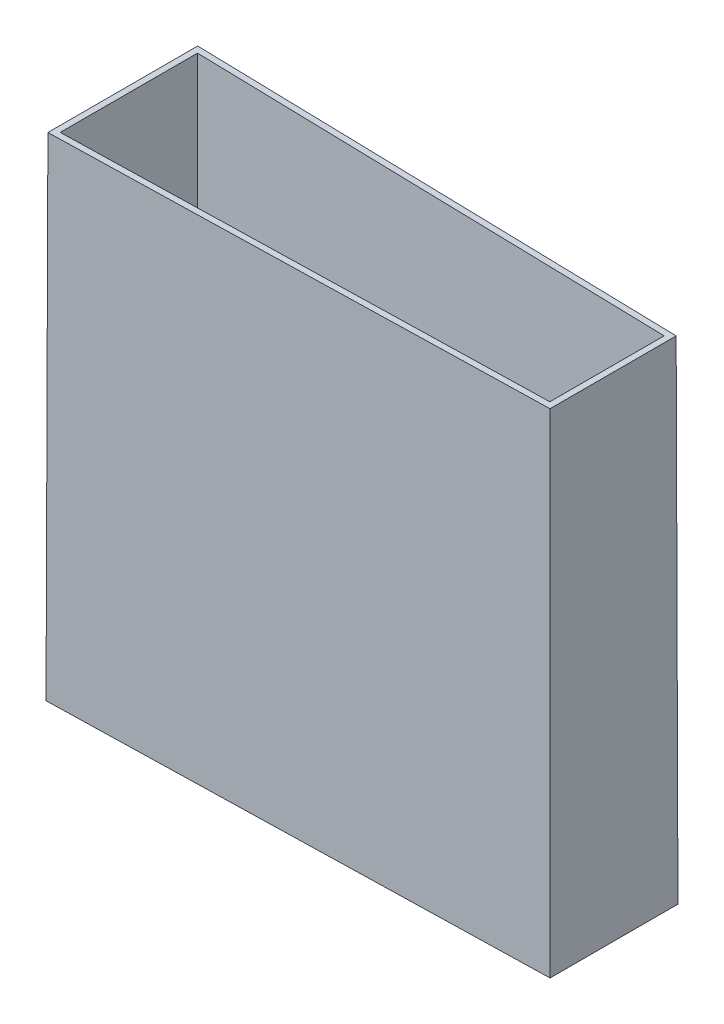
from build123d import *


with BuildPart() as part:
    # Bottom → Magazine Body section 0
    with BuildSketch(Plane(origin=(0, 0, 0), x_dir=(1, 0, 0), z_dir=(0, 1, 0))):
        with BuildLine():
            Line((-7.648338397, 10.646601169), (-7.648338397, -14.253398831))
            Line((-7.648338397, -14.253398831), (73.151661603, -12.299887169))
            Line((73.151661603, -12.299887169), (73.151661603, 8.700112831))
            Line((73.151661603, 8.700112831), (-7.648338397, 10.646601169))
        make_face()
    # Top → Magazine Body section 1
    with BuildSketch(Plane(origin=(0, 80.8, 0), x_dir=(1, 0, 0), z_dir=(0, 1, 0))):
        with BuildLine():
            Line((73.001661603, -12.153469905), (73.001661603, 8.553682842))
            Line((73.001661603, 8.553682842), (-7.498338397, 10.49294412))
            Line((-7.498338397, 10.49294412), (-7.498338397, -14.099728429))
            Line((-7.498338397, -14.099728429), (73.001661603, -12.153469905))
        make_face()
    loft()

    # Sketch4 → Magazine Inner Cut section 0
    with BuildSketch(Plane(origin=(0, 1, 0), x_dir=(-1, 0, 0), z_dir=(0, -1, 0))):
        with BuildLine():
            Line((6.648338397, -13.228929483), (6.648338397, 9.62222084))
            Line((6.648338397, 9.62222084), (-72.151661603, 7.723912906))
            Line((-72.151661603, 7.723912906), (-72.151661603, -11.32377207))
            Line((-72.151661603, -11.32377207), (6.648338397, -13.228929483))
        make_face()
    # Sketch5 → Magazine Inner Cut section 1
    with BuildSketch(Plane(origin=(0, 80.8, 0), x_dir=(1, 0, 0), z_dir=(0, 1, 0))):
        with BuildLine():
            Line((72.001661603, -11.177354805), (72.001661603, 7.577482917))
            Line((72.001661603, 7.577482917), (-6.498338397, 9.468563791))
            Line((-6.498338397, 9.468563791), (-6.498338397, -13.07525908))
            Line((-6.498338397, -13.07525908), (72.001661603, -11.177354805))
        make_face()
    loft(mode=Mode.SUBTRACT)


solid = part.part
